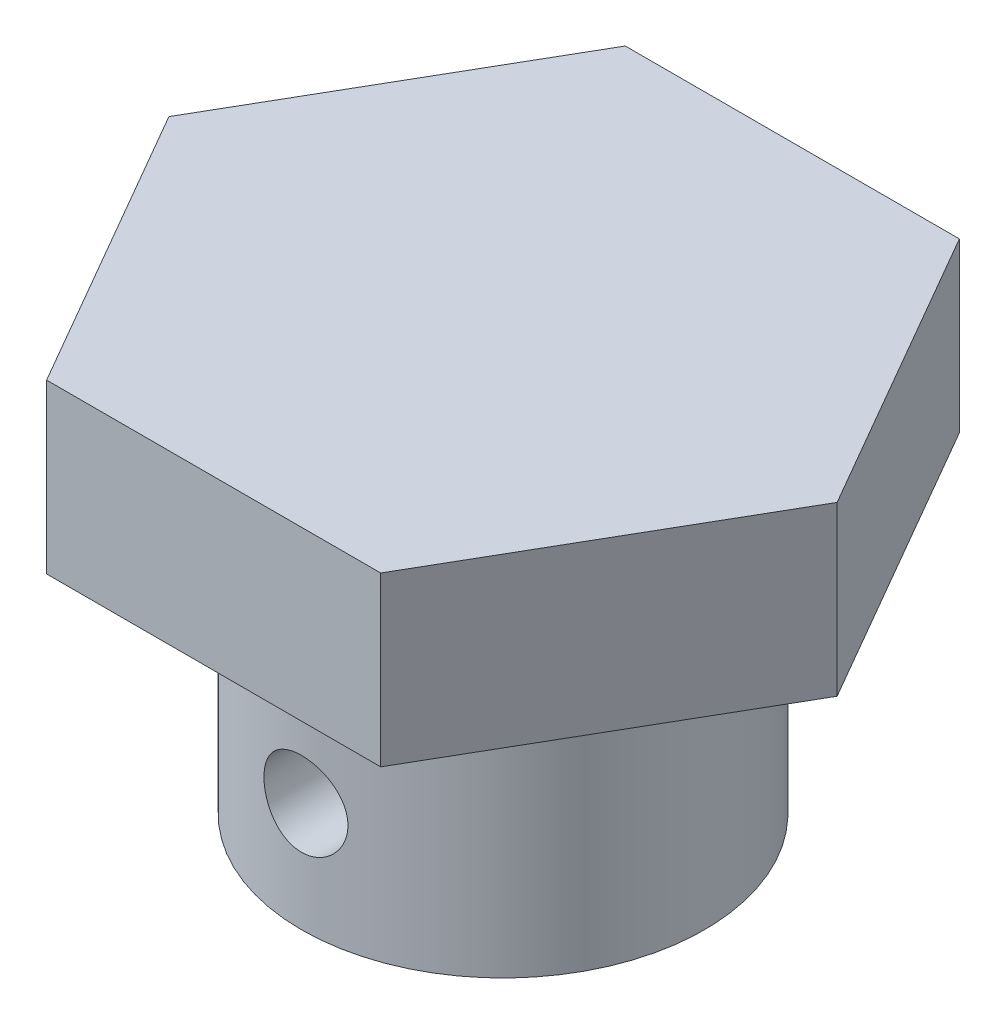
from build123d import *

# Parameters (mm, degrees)
CROQUIS1_W                  = 6
CROQUIS1_H                  = 8
SALIENTE_EXTRUIR1_DEPTH     = 5
REDONDEO4_R                 = 1.5
SKETCH6_R                   = 4
CUT_EXTRUDE1_DEPTH          = 10
TAP_DRILL_FOR_M3X0_5_TAP1_D = 2.5


with BuildPart() as part:
    # Croquis1 → Revolución1 (revolve)
    with BuildSketch(Plane(origin=(0, 0, 0), x_dir=(0, 0, -1), z_dir=(1, 0, 0)), mode=Mode.PRIVATE) as revoluci_n1_sk:
        with Locations((-3, 4)):
            Rectangle(CROQUIS1_W, CROQUIS1_H)
    revolve(revoluci_n1_sk.sketch.rotate(Axis((0, 0, 0), (0, 1, 0)), 180), axis=Axis((0, 0, 0), (0, 1, 0)))

    # Croquis2 → Saliente-Extruir1 (add)
    with BuildSketch(Plane(origin=(0, 8, 0), x_dir=(1, 0, 0), z_dir=(0, 1, 0))):
        Polygon((-9.95, 0), (-4.975, -8.616952768), (4.975, -8.616952768), (9.95, 0), (4.975, 8.616952768), (-4.975, 8.616952768), align=None)
    extrude(amount=SALIENTE_EXTRUIR1_DEPTH)

    # Redondeo4
    redondeo4_edges = [part.edges().sort_by_distance(p)[0] for p in [
        (0, 8, 6),
    ]]
    fillet(redondeo4_edges, radius=REDONDEO4_R)

    # Sketch6 → Cut-Extrude1 (cut)
    with BuildSketch(Plane.XZ):
        with Locations(Location((0, 0, 0), (0, 0, 270))):
            Circle(SKETCH6_R)
    extrude(amount=-CUT_EXTRUDE1_DEPTH, mode=Mode.SUBTRACT)

    # Tap Drill for M3x0.5 Tap1 (through all)
    with Locations(Plane(origin=(0, 3.25, 6), x_dir=(1, 0, 0), z_dir=(0, 0, 1))):
        with Locations((0, 0)):
            Hole(TAP_DRILL_FOR_M3X0_5_TAP1_D / 2)


solid = part.part
